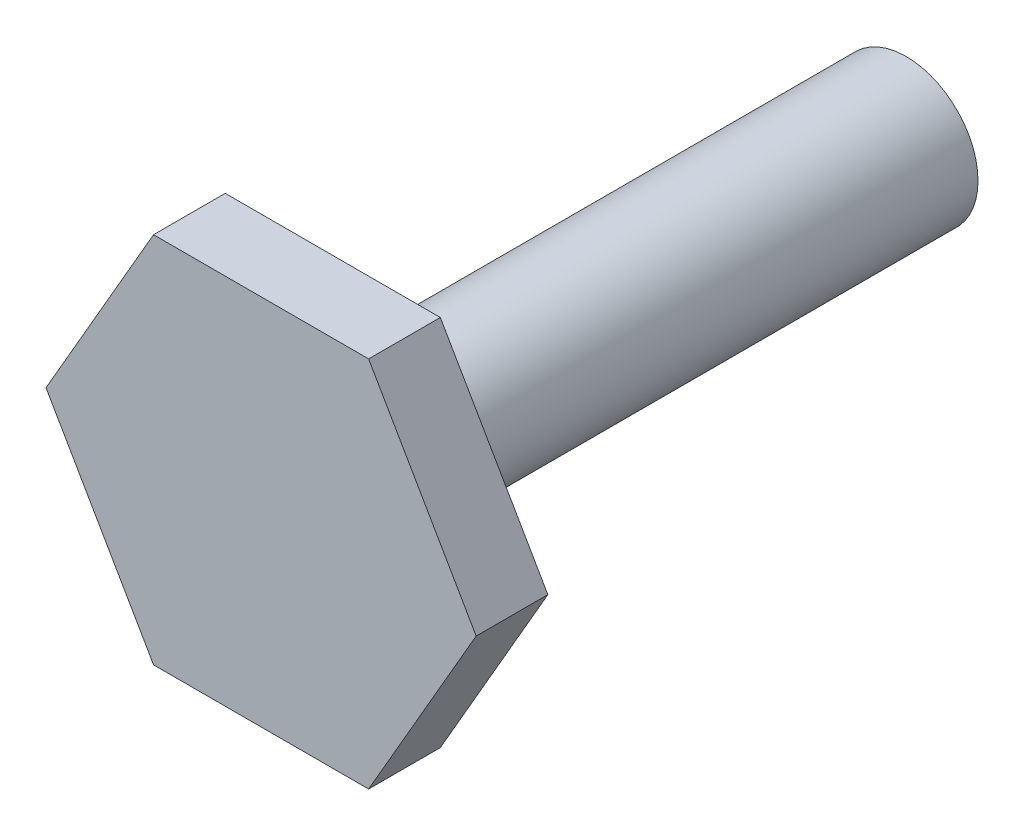
from build123d import *

# Parameters (mm, degrees)
SKETCH1_R           = 3.175
BOSS_EXTRUDE1_DEPTH = 12.7
BOSS_EXTRUDE3_DEPTH = 3.175


with BuildPart() as part:
    # Sketch1 → Boss-Extrude1 (new, symmetric)
    with BuildSketch(Plane.XY):
        Circle(SKETCH1_R)
    extrude(amount=BOSS_EXTRUDE1_DEPTH, both=True)

    # Sketch2 → Boss-Extrude3 (add)
    with BuildSketch(Plane.XY.offset(12.7)):
        Polygon((9.525, 0), (4.7625, 8.248891971), (-4.7625, 8.248891971), (-9.525, 0), (-4.7625, -8.248891971), (4.7625, -8.248891971), align=None)
    extrude(amount=BOSS_EXTRUDE3_DEPTH)


solid = part.part
